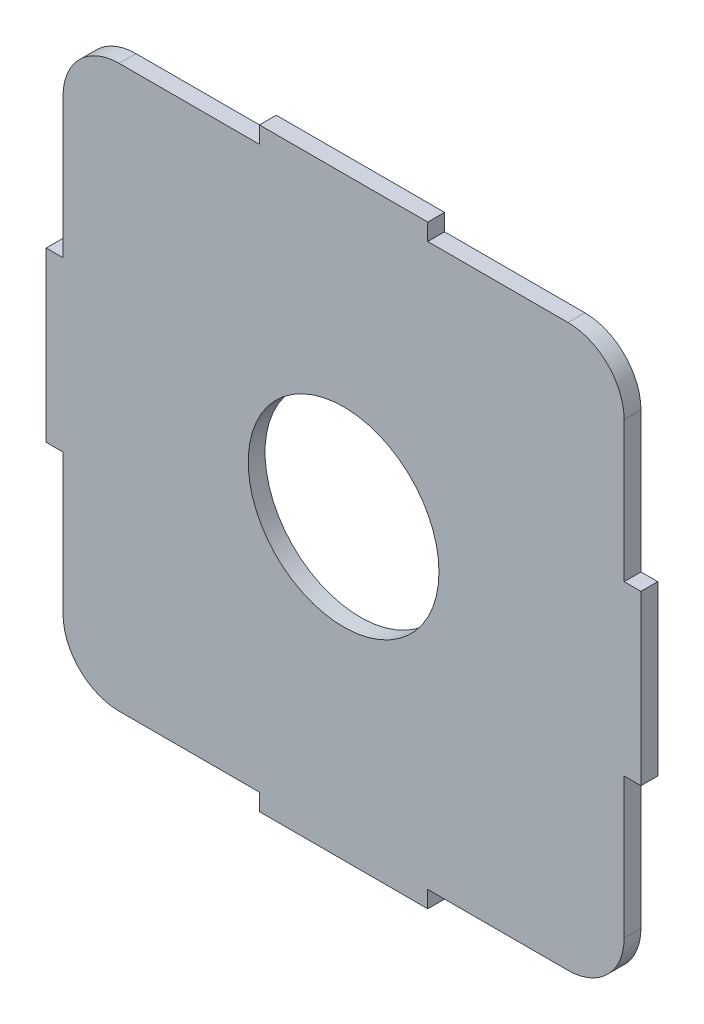
from build123d import *

# Parameters (mm, degrees)
BOSS_EXTRU_1_DEPTH      = 3
ESQUISSE2_R             = 17
ENL_V_MAT_EXTRU_1_DEPTH = 3
CONG_1_R                = 10


with BuildPart() as part:
    # Esquisse1 → Boss.-Extru.1 (new body)
    with BuildSketch(Plane.XY):
        Polygon((0, 0), (0, 35), (-3, 35), (-3, 65), (0, 65), (0, 100), (35, 100), (35, 103), (65, 103), (65, 100), (100, 100), (100, 65), (103, 65), (103, 35), (100, 35), (100, 0), (65, 0), (65, -3), (35, -3), (35, 0), align=None)
    extrude(amount=BOSS_EXTRU_1_DEPTH)

    # Esquisse2 → Enlèv. mat.-Extru.1 (cut)
    with BuildSketch(Plane.XY.offset(3)):
        with Locations((50, 50)):
            Circle(ESQUISSE2_R)
    extrude(amount=-ENL_V_MAT_EXTRU_1_DEPTH, mode=Mode.SUBTRACT)

    # Congé1
    cong_1_edges = [part.edges().sort_by_distance(p)[0] for p in [
        (0, 0, 1.5),
        (0, 100, 1.5),
        (100, 100, 1.5),
        (100, 0, 1.5),
    ]]
    fillet(cong_1_edges, radius=CONG_1_R)


solid = part.part
